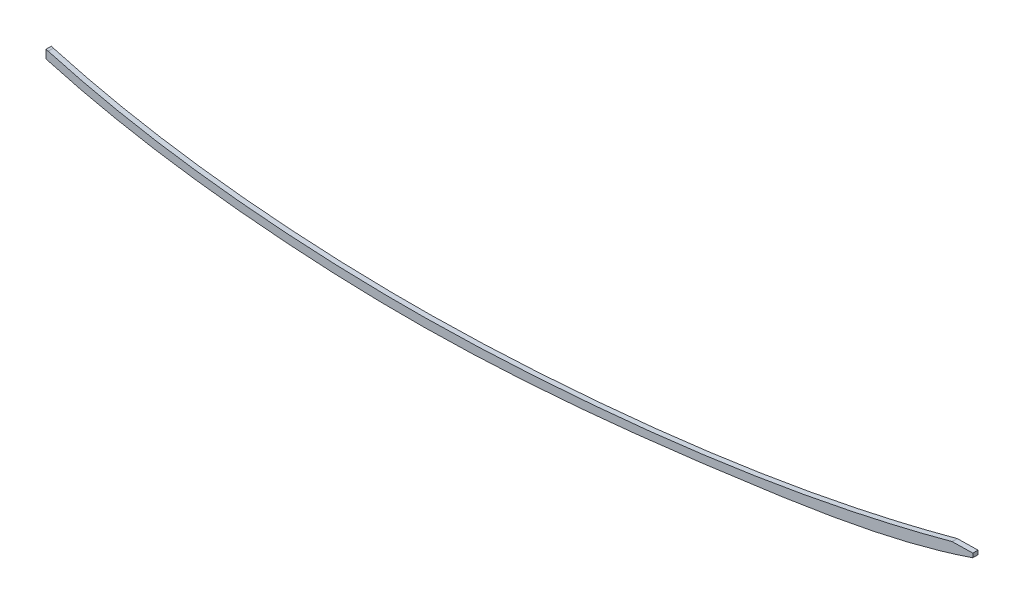
from build123d import *

# Parameters (mm, degrees)
BOSS_EXTRUDE1_DEPTH = 3.2


with BuildPart() as part:
    # Sketch1 → Boss-Extrude1 (new body)
    with BuildSketch(Plane.XY):
        with BuildLine():
            Line((339.743877836, -1.97092204), (327.028680724, -2.207358466))
            add(Edge.make_bspline(
                [(-228.638126642, -18.965520589), (-205.328000422, -25.564091644), (-169.71378297, -33.048286306), (-121.506682722, -39.379688009), (-73.01231088, -43.707584978), (-12.203336667, -45.868404467), (48.636352849, -44.036231472), (97.255668277, -40.66150775), (145.796442696, -36.203035302), (206.192712118, -28.441379937), (266.013860499, -17.275577293), (306.123232335, -7.743192742), (322.472206916, -3.440078745), (327.028680724, -2.207358466)],
                knots=[0, 0, 0, 0, 0.125, 0.1875, 0.25, 0.375, 0.5, 0.5625, 0.625, 0.75, 0.875, 0.9375, 0.961706413, 0.961706413, 0.961706413, 0.961706413], degree=3))
            Line((-228.638126642, -18.965520589), (-229.999999898, -18.580004982))
            Line((-229.999999898, -18.580004982), (-229.999999898, -23.776476963))
            add(Edge.make_bspline(
                [(-229.999999898, -23.776476963), (-187.624946823, -35.810765879), (-110.757346564, -47.307733367), (0.007380653, -52.092222889), (100.344733064, -46.361807952), (200.209241181, -34.219669393), (281.165485841, -22.017381692), (326.582041192, -8.953425301), (339.743877836, -4.478430193)],
                knots=[0, 0, 0, 0, 0.225071004, 0.395640197, 0.566277038, 0.737858903, 0.910958545, 0.981893873, 0.981893873, 0.981893873, 0.981893873], degree=3))
            Line((339.743877836, -4.478430193), (339.743877836, -1.97092204))
        make_face()
    extrude(amount=BOSS_EXTRUDE1_DEPTH)


solid = part.part
